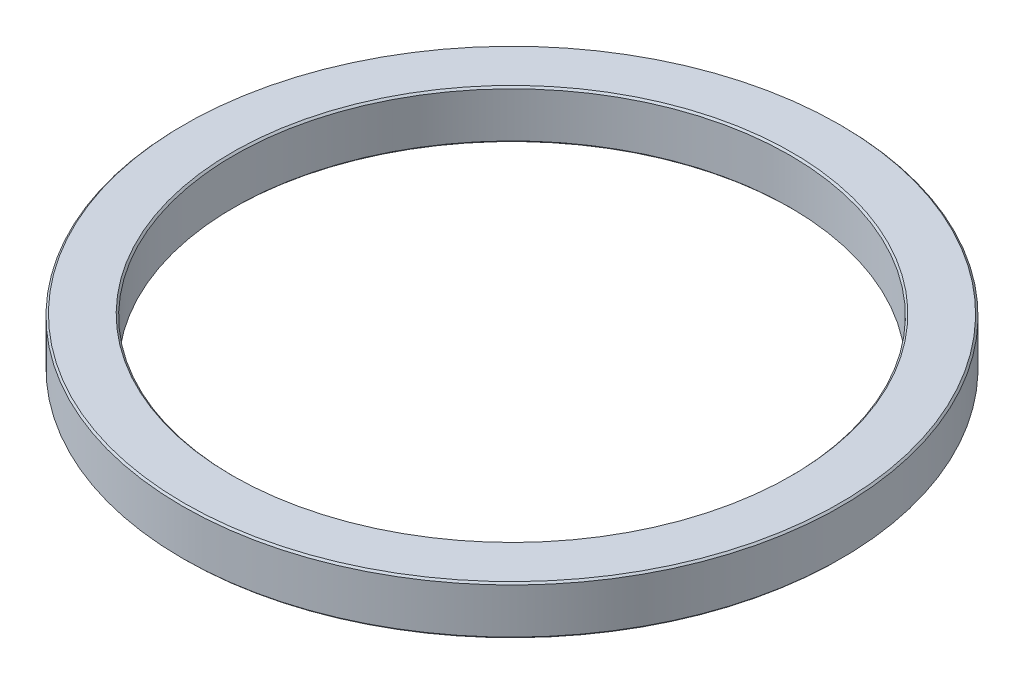
from build123d import *

# Parameters (mm, degrees)
SKETCH_1_R      = 94.9
SKETCH_1_R_2    = 80.1
EXTRUDE_1_DEPTH = 14
CHAMFER_1_SIZE  = 0.5


with BuildPart() as part:
    # 草图1 → 凸台-拉伸1 (new body)
    with BuildSketch(Plane(origin=(0, 0, 0), x_dir=(1, 0, 0), z_dir=(0, 1, 0))):
        with Locations(Location((0, 0, 0), (0, 0, 270))):
            Circle(SKETCH_1_R)
        with Locations(Location((0, 0, 0), (0, 0, 270))):
            Circle(SKETCH_1_R_2, mode=Mode.SUBTRACT)
    extrude(amount=EXTRUDE_1_DEPTH)

    # 倒角1
    chamfer_1_edges = [part.edges().sort_by_distance(p)[0] for p in [
        (0, 0, -94.9),
        (0, 14, -94.9),
        (0, 0, -80.1),
        (0, 14, -80.1),
    ]]
    chamfer(chamfer_1_edges, length=CHAMFER_1_SIZE)


solid = part.part
